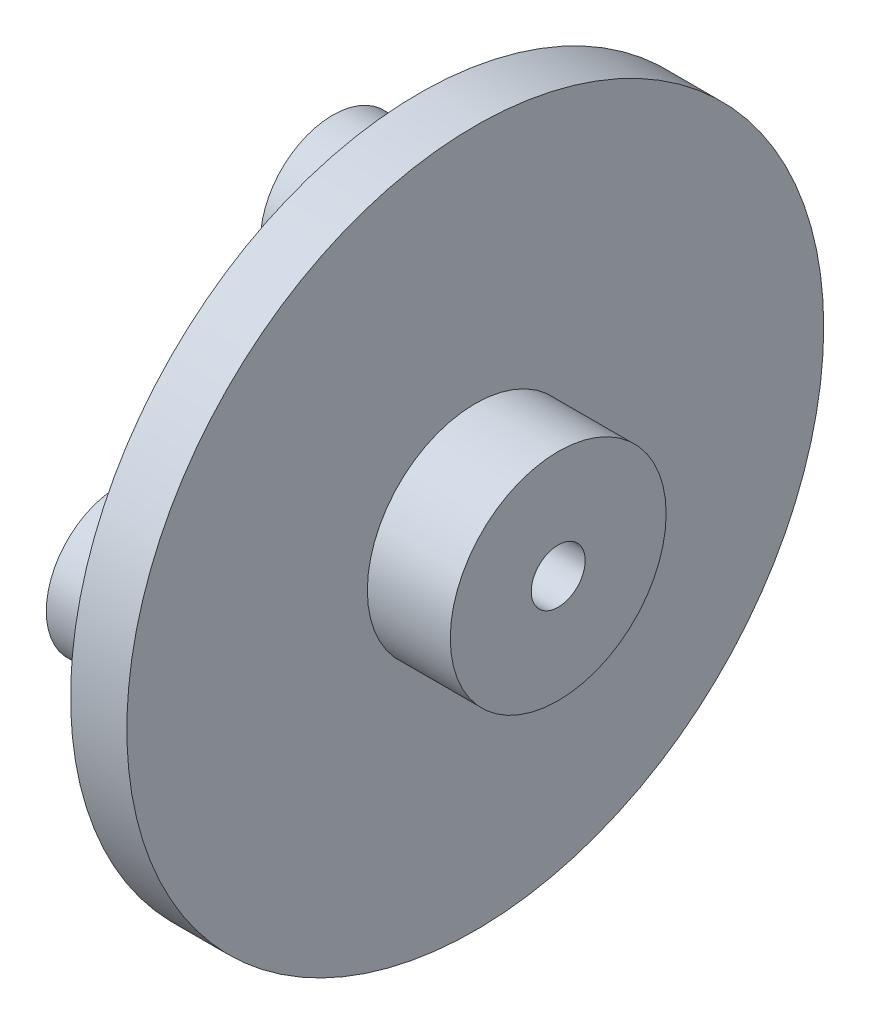
from build123d import *

# Parameters (mm, degrees)
SKETCH2_R           = 4.25
BOSS_EXTRUDE1_DEPTH = 5.08


with BuildPart() as part:
    # Sketch1 → Revolve1 (revolve)
    with BuildSketch(Plane.XY):
        Polygon((0, 1.5875), (0, 6.35), (-4.87911158, 6.35), (-4.87911158, 20.5), (-8.187387237, 20.5), (-8.187387237, 1.5875), align=None)
    revolve(axis=Axis((0, 0, 0), (-1, 0, 0)))

    # Sketch2 → Boss-Extrude1 (add)
    with BuildSketch(Plane.ZY.offset(8.187387237)):
        with Locations((0, 12.6)):
            Circle(SKETCH2_R)
        with Locations((12.6, 0)):
            Circle(SKETCH2_R)
        with Locations((0, -12.6)):
            Circle(SKETCH2_R)
        with Locations((-12.6, 0)):
            Circle(SKETCH2_R)
    extrude(amount=BOSS_EXTRUDE1_DEPTH)


solid = part.part
